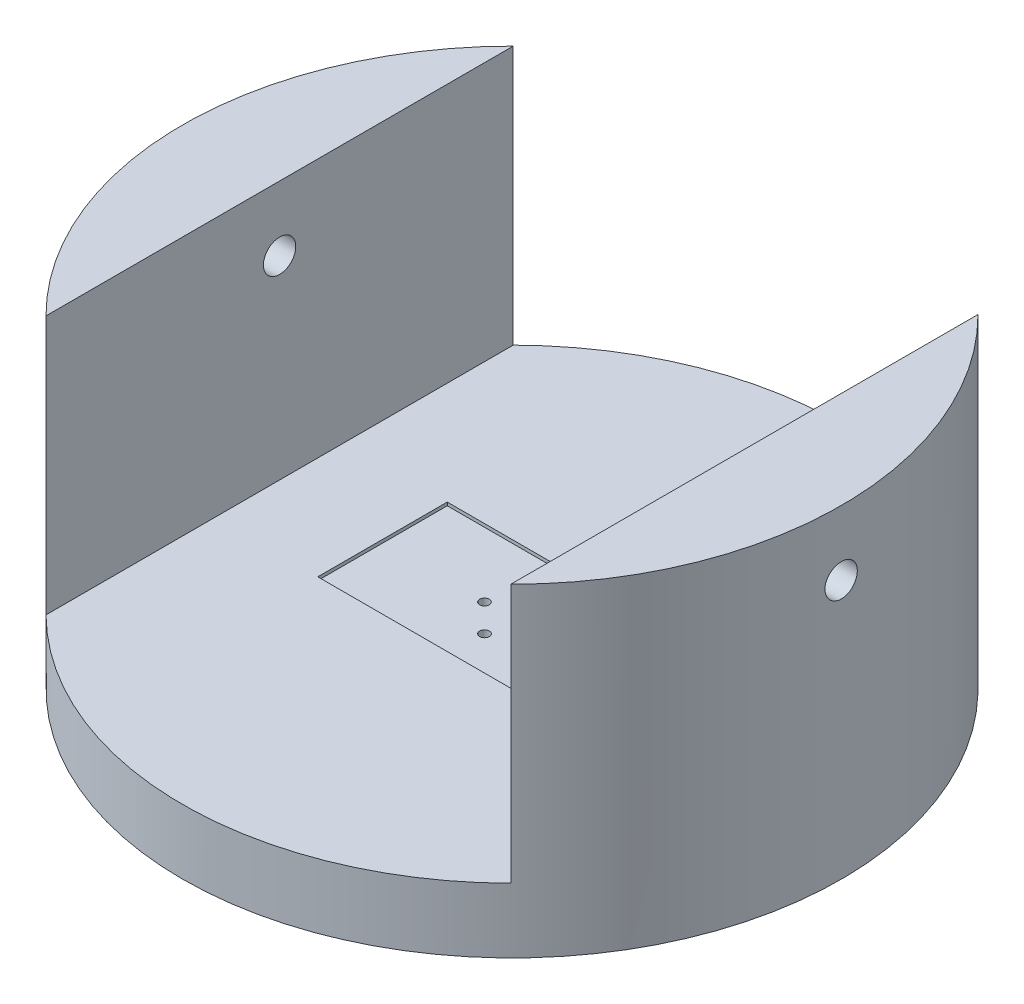
from build123d import *

# Parameters (mm, degrees)
SKETCH1_R               = 50.9
BOSS_EXTRUDE1_DEPTH     = 10
BOSS_EXTRUDE2_DEPTH     = 40
SKETCH3_W               = 40
SKETCH3_H               = 20
CUT_EXTRUDE1_DEPTH      = 0.5
CUT_EXTRUDE2_DEPTH      = 113.361247768
CUT_EXTRUDE2_DEPTH_BACK = 113.361247768
SKETCH4_R               = 2.5
SKETCH5_R               = 0.75
CUT_EXTRUDE3_DEPTH      = 88.644851647


with BuildPart() as part:
    # Sketch1 → Boss-Extrude1 (new body)
    with BuildSketch(Plane(origin=(0, 0, 0), x_dir=(1, 0, 0), z_dir=(0, 1, 0))):
        with Locations(Location((0, 0, 0), (0, 0, 270))):
            Circle(SKETCH1_R)
    extrude(amount=BOSS_EXTRUDE1_DEPTH)

    # Sketch2 → Boss-Extrude2 (add)
    with BuildSketch(Plane(origin=(0, 10, 0), x_dir=(1, 0, 0), z_dir=(0, 1, 0))):
        with BuildLine():
            Line((-35.9, 36.083237105), (-35.9, -36.083237105))
            ThreePointArc((-35.9, -36.083237105), (-50.9, 0), (-35.9, 36.083237105))
        make_face()
        with BuildLine():
            Line((35.9, 36.083237105), (35.9, -36.083237105))
            ThreePointArc((35.9, -36.083237105), (50.9, 0), (35.9, 36.083237105))
        make_face()
    extrude(amount=BOSS_EXTRUDE2_DEPTH)

    # Sketch3 → Cut-Extrude1 (cut)
    with BuildSketch(Plane(origin=(0, 10, 0), x_dir=(1, 0, 0), z_dir=(0, 1, 0))):
        Rectangle(SKETCH3_W, SKETCH3_H)
    extrude(amount=-CUT_EXTRUDE1_DEPTH, mode=Mode.SUBTRACT)

    # Sketch4 → Cut-Extrude2 (cut, two sides: drawn at the far end of the back side and taken through both)
    with BuildSketch(Plane.ZY.offset(-35.9).offset(-CUT_EXTRUDE2_DEPTH_BACK)):
        with Locations(Location((0, 40, 0), (0, 0, 270))):
            Circle(SKETCH4_R)
    extrude(amount=CUT_EXTRUDE2_DEPTH + CUT_EXTRUDE2_DEPTH_BACK, mode=Mode.SUBTRACT)

    # Sketch5 → Cut-Extrude3 (cut, through all)
    with BuildSketch(Plane.XZ):
        with Locations(Location((-4.25, 0, 0), (0, 0, 270))):
            Circle(SKETCH5_R)
        with Locations(Location((0, 4.25, 0), (0, 0, 270))):
            Circle(SKETCH5_R)
        with Locations(Location((4.25, 0, 0), (0, 0, 270))):
            Circle(SKETCH5_R)
        with Locations(Location((0, -4.25, 0), (0, 0, 270))):
            Circle(SKETCH5_R)
    extrude(amount=-CUT_EXTRUDE3_DEPTH, mode=Mode.SUBTRACT)


solid = part.part
